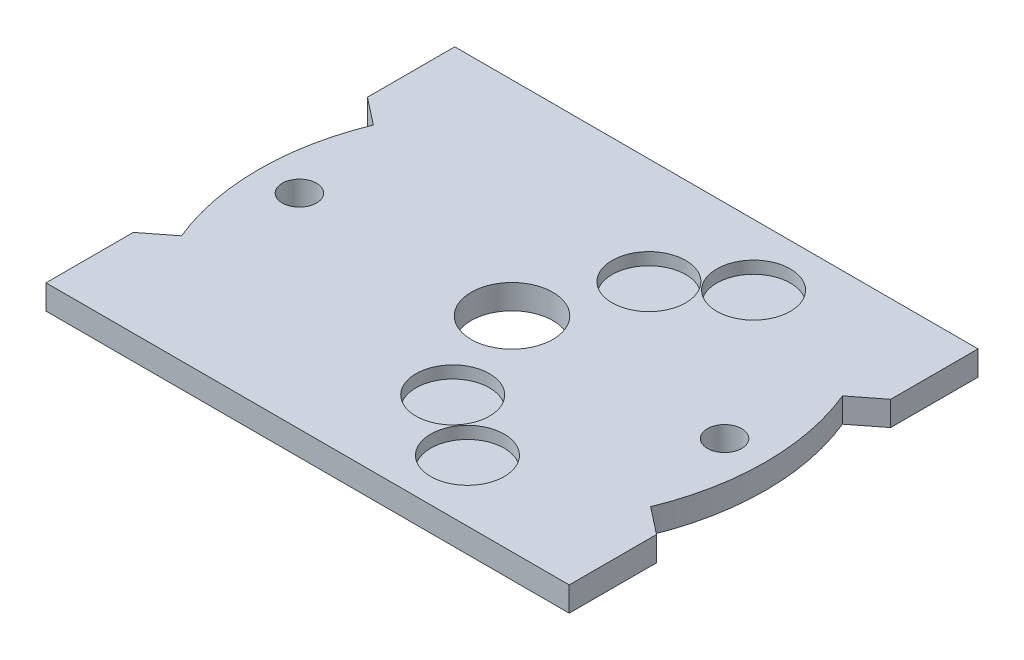
from build123d import *

# Parameters (mm, degrees)
SKETCH1_R           = 2.1
BOSS_EXTRUDE2_DEPTH = 3
SKETCH1_14_R        = 5
CUT_EXTRUDE2_DEPTH  = 10
SKETCH2_R           = 4.5
CUT_EXTRUDE3_DEPTH  = 1.5


with BuildPart() as part:
    # Sketch1 → Boss-Extrude2 (new body)
    with BuildSketch(Plane(origin=(0, 0, 0), x_dir=(1, 0, 0), z_dir=(0, 1, 0))):
        with BuildLine():
            Line((32, -25), (32, -14.320549047))
            Line((32, -14.320549047), (28.692414075, -11.736497543))
            ThreePointArc((28.692414075, -11.736497543), (31, 0), (28.692414075, 11.736497543))
            Line((28.692414075, 11.736497543), (32, 14.320549047))
            Line((32, 14.320549047), (32, 25))
            Line((32, 25), (-32, 25))
            Line((-32, 25), (-32, 14.320549047))
            Line((-32, 14.320549047), (-28.692414075, 11.736497543))
            ThreePointArc((-28.692414075, 11.736497543), (-31, 0), (-28.692414075, -11.736497543))
            Line((-28.692414075, -11.736497543), (-32, -14.320549047))
            Line((-32, -14.320549047), (-32, -25))
            Line((-32, -25), (32, -25))
        make_face()
        with Locations((26, 0)):
            Circle(SKETCH1_R, mode=Mode.SUBTRACT)
        with Locations((-26, 0)):
            Circle(SKETCH1_R, mode=Mode.SUBTRACT)
    extrude(amount=BOSS_EXTRUDE2_DEPTH)

    # Sketch1<14> → Cut-Extrude2 (cut)
    with BuildSketch(Plane(origin=(0, 0, 0), x_dir=(1, 0, 0), z_dir=(0, 1, 0))):
        Circle(SKETCH1_14_R)
    extrude(amount=CUT_EXTRUDE2_DEPTH, mode=Mode.SUBTRACT)

    # Sketch2 → Cut-Extrude3 (cut)
    with BuildSketch(Plane(origin=(0, 3, 0), x_dir=(1, 0, 0), z_dir=(0, 1, 0))):
        with Locations((4.75, 12)):
            Circle(SKETCH2_R)
        with Locations((12.05, 17.5)):
            Circle(SKETCH2_R)
        with Locations((4.75, -12)):
            Circle(SKETCH2_R)
        with Locations((12.05, -17.5)):
            Circle(SKETCH2_R)
    extrude(amount=-CUT_EXTRUDE3_DEPTH, mode=Mode.SUBTRACT)


solid = part.part
